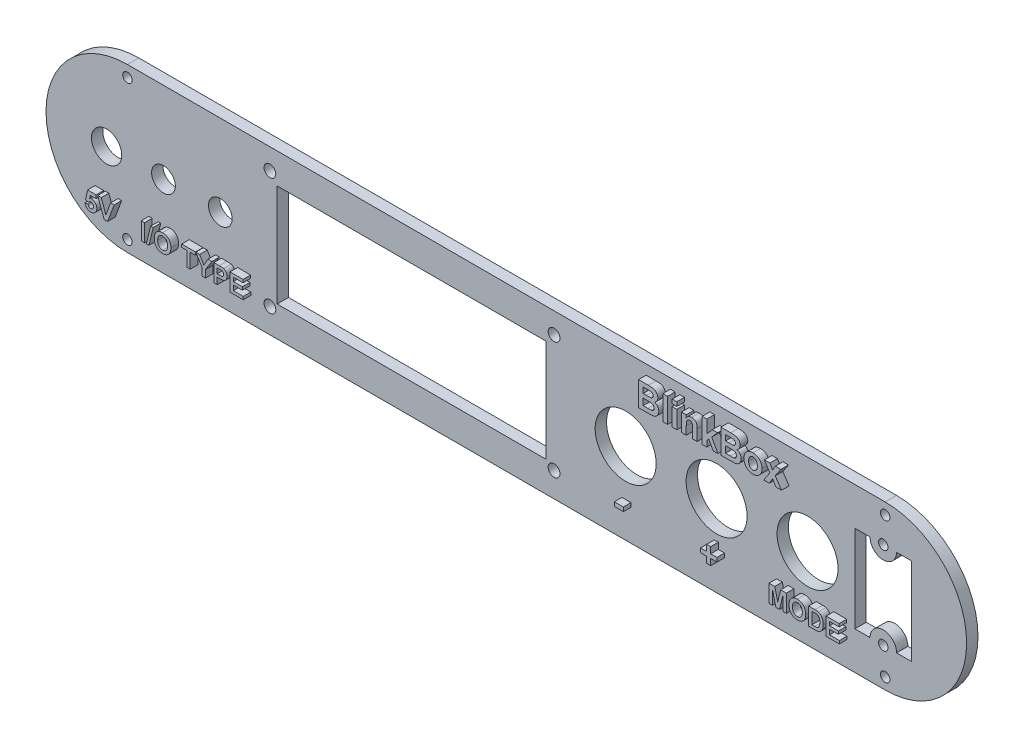
from build123d import *

# Parameters (mm, degrees)
BOSS_EXTRUDE1_DEPTH     = 3
CUT_EXTRUDE1_DEPTH      = 124.424065725
CUT_EXTRUDE1_DEPTH_BACK = 124.424065725
SKETCH2_R               = 4
SKETCH2_R_2             = 3.135
SKETCH2_R_3             = 8.05
SKETCH2_W               = 71
SKETCH2_H               = 27
CUT_EXTRUDE2_DEPTH      = 124.424065725
CUT_EXTRUDE2_DEPTH_BACK = 124.424065725
SKETCH5_R               = 1.55
CUT_EXTRUDE5_DEPTH      = 124.424065725
CUT_EXTRUDE5_DEPTH_BACK = 124.424065725
SKETCH6_R               = 1.25
CUT_EXTRUDE4_DEPTH      = 124.424065725
CUT_EXTRUDE4_DEPTH_BACK = 124.424065725
SKETCH8_R               = 1.25
SKETCH9_W               = 0.889033391
SKETCH9_H               = 4.622973633
SKETCH9_W_2             = 2.387219291
SKETCH9_H_2             = 1.070132785
SKETCH9_W_3             = 1.234768599
SKETCH9_H_3             = 6.420796712
SKETCH9_H_4             = 4.692120674
BOSS_EXTRUDE2_DEPTH     = 2


with BuildPart() as part:
    # Sketch1 → Boss-Extrude1 (new body)
    with BuildSketch(Plane.XY):
        with BuildLine():
            Line((-100, 21.5), (100, 21.5))
            ThreePointArc((100, 21.5), (121.5, 0), (100, -21.5))
            Line((100, -21.5), (-100, -21.5))
            ThreePointArc((-100, -21.5), (-121.5, 0), (-100, 21.5))
        make_face()
    extrude(amount=BOSS_EXTRUDE1_DEPTH)

    # Sketch2 → Cut-Extrude1 (cut, two sides: drawn at the far end of the back side and taken through both)
    with BuildSketch(Plane.XY.offset(3).offset(-CUT_EXTRUDE1_DEPTH_BACK)):
        with Locations((-105.5, 0)):
            Circle(SKETCH2_R)
        with Locations((-90.5, 0)):
            Circle(SKETCH2_R_2)
        with Locations((-75.5, 0)):
            Circle(SKETCH2_R_2)
        with Locations((55.5, 0)):
            Circle(SKETCH2_R_3)
        with Locations((31.5, 0)):
            Circle(SKETCH2_R_3)
        with Locations((79.5, 0)):
            Circle(SKETCH2_R_3)
        with Locations((-25, 0)):
            Rectangle(SKETCH2_W, SKETCH2_H)
    extrude(amount=CUT_EXTRUDE1_DEPTH + CUT_EXTRUDE1_DEPTH_BACK, mode=Mode.SUBTRACT)

    # Sketch5 → Cut-Extrude2 (cut, two sides: drawn at the far end of the back side and taken through both)
    with BuildSketch(Plane.XY.offset(3).offset(-CUT_EXTRUDE2_DEPTH_BACK)):
        with Locations((-62.4, 16)):
            Circle(SKETCH5_R)
        with Locations((-62.4, -15)):
            Circle(SKETCH5_R)
        with Locations((12.6, -15)):
            Circle(SKETCH5_R)
        with Locations((12.6, 16)):
            Circle(SKETCH5_R)
    extrude(amount=CUT_EXTRUDE2_DEPTH + CUT_EXTRUDE2_DEPTH_BACK, mode=Mode.SUBTRACT)

    # Sketch6 → Cut-Extrude5 (cut, two sides: drawn at the far end of the back side and taken through both)
    with BuildSketch(Plane.XY.offset(3).offset(-CUT_EXTRUDE5_DEPTH_BACK)):
        with BuildLine():
            Line((99.5, -8), (99.5, 8))
            ThreePointArc((99.5, 8), (97.025126266, 9.025126266), (96, 11.5))
            Line((96, 11.5), (92, 11.5))
            Line((92, 11.5), (92, -11.5))
            Line((92, -11.5), (96, -11.5))
            ThreePointArc((96, -11.5), (97.025126266, -9.025126266), (99.5, -8))
        make_face()
        with BuildLine():
            ThreePointArc((103, 11.5), (101.974873734, 9.025126266), (99.5, 8))
            Line((99.5, 8), (99.5, -8))
            ThreePointArc((99.5, -8), (101.974873734, -9.025126266), (103, -11.5))
            Line((103, -11.5), (107, -11.5))
            Line((107, -11.5), (107, 11.5))
            Line((107, 11.5), (103, 11.5))
        make_face()
        with BuildLine():
            ThreePointArc((100.75, -11.5), (100.383883476, -10.616116524), (99.5, -10.25))
            Line((99.5, -10.25), (99.5, -11.5))
            Line((99.5, -11.5), (100.75, -11.5))
        make_face()
        with BuildLine():
            Line((99.5, -11.5), (99.5, -10.25))
            ThreePointArc((99.5, -10.25), (98.616116524, -10.616116524), (98.25, -11.5))
            Line((98.25, -11.5), (99.5, -11.5))
        make_face()
        with BuildLine():
            ThreePointArc((100.75, -11.5), (100.383883476, -10.616116524), (99.5, -10.25))
            Line((99.5, -10.25), (99.5, -11.5))
            Line((99.5, -11.5), (100.75, -11.5))
        make_face()
        with BuildLine():
            Line((99.5, -11.5), (99.5, -10.25))
            ThreePointArc((99.5, -10.25), (98.616116524, -10.616116524), (98.25, -11.5))
            Line((98.25, -11.5), (99.5, -11.5))
        make_face()
        with BuildLine():
            Line((100.75, -11.5), (99.5, -11.5))
            Line((99.5, -11.5), (98.25, -11.5))
            ThreePointArc((98.25, -11.5), (99.5, -12.75), (100.75, -11.5))
        make_face()
        with Locations((99.5, 11.5)):
            Circle(SKETCH6_R)
    extrude(amount=CUT_EXTRUDE5_DEPTH + CUT_EXTRUDE5_DEPTH_BACK, mode=Mode.SUBTRACT)

    # Sketch8 → Cut-Extrude4 (cut, two sides: drawn at the far end of the back side and taken through both)
    with BuildSketch(Plane.XY.offset(3).offset(-CUT_EXTRUDE4_DEPTH_BACK)):
        with Locations((-100, 18.5)):
            Circle(SKETCH8_R)
        with Locations((-100, -18.5)):
            Circle(SKETCH8_R)
        with Locations((100, 18.5)):
            Circle(SKETCH8_R)
        with Locations((100, -18.5)):
            Circle(SKETCH8_R)
    extrude(amount=CUT_EXTRUDE4_DEPTH + CUT_EXTRUDE4_DEPTH_BACK, mode=Mode.SUBTRACT)

    # Sketch9 → Boss-Extrude2 (add)
    # profile 1 of 24: a face of its own
    with BuildSketch(Plane.XY.offset(3)):
        with BuildLine():
            Line((-109.174671349, -13.677562831), (-108.404175744, -13.577546575))
            add(Edge.make_bspline(
                [(-108.404175744, -13.577546575), (-108.395651989, -13.629799104), (-108.379238094, -13.730419961), (-108.328284401, -13.870894407), (-108.257324391, -13.994646784), (-108.166127839, -14.098851173), (-108.062334716, -14.183599766), (-107.947669436, -14.244018169), (-107.825605192, -14.28205759), (-107.74106705, -14.286524418), (-107.69850549, -14.288773287)],
                knots=[0, 0, 0, 0, 1.154848647, 2.223851388, 3.245409892, 4.254330626, 5.232966172, 6.156270698, 7.071756339, 8, 8, 8, 8], degree=3))
            add(Edge.make_bspline(
                [(-107.69850549, -14.288773287), (-107.67377931, -14.288338875), (-107.625377432, -14.287488507), (-107.554050291, -14.277835736), (-107.485913267, -14.262153359), (-107.420321692, -14.240869461), (-107.357958746, -14.212876617), (-107.298768979, -14.178620702), (-107.242531196, -14.138053589), (-107.188960746, -14.092182769), (-107.13946122, -14.039810511), (-107.098091971, -13.979526163), (-107.061444045, -13.914410497), (-107.031589229, -13.842694532), (-107.010068065, -13.764126938), (-106.992946429, -13.680052742), (-106.984218646, -13.589456903), (-106.982572293, -13.527244588), (-106.981722318, -13.495125771)],
                knots=[0, 0, 0, 0, 0.981268084, 1.920847364, 2.851509818, 3.754644372, 4.654445699, 5.560569672, 6.465366234, 7.403985617, 8.358004942, 9.316972086, 10.299158387, 11.321223707, 12.392031981, 13.529051644, 14.724304971, 16, 16, 16, 16], degree=3))
            add(Edge.make_bspline(
                [(-106.981722318, -13.495125771), (-106.982202921, -13.464850001), (-106.983131766, -13.406337085), (-106.99174927, -13.321561748), (-107.004977091, -13.242338412), (-107.026020467, -13.169246316), (-107.050053658, -13.10092667), (-107.082456459, -13.039800954), (-107.118010591, -12.983213739), (-107.161345679, -12.934218192), (-107.208563215, -12.890927487), (-107.258849728, -12.85235618), (-107.312769717, -12.820172137), (-107.369786286, -12.792548802), (-107.430887815, -12.7724281), (-107.495578692, -12.759041888), (-107.562989078, -12.748992872), (-107.609254216, -12.748189924), (-107.632754062, -12.747782076)],
                knots=[0, 0, 0, 0, 1.29221626, 2.497420946, 3.635005972, 4.715822244, 5.741640361, 6.720139245, 7.663294346, 8.588224307, 9.502291809, 10.395891443, 11.288713187, 12.178904539, 13.095818132, 14.026458458, 14.997562253, 16, 16, 16, 16], degree=3))
            add(Edge.make_bspline(
                [(-107.632754062, -12.747782076), (-107.662465132, -12.748847262), (-107.721739184, -12.750972324), (-107.809238336, -12.768247003), (-107.894404844, -12.796370302), (-107.977150188, -12.835519891), (-108.057255452, -12.886008613), (-108.134373818, -12.948003903), (-108.209829064, -13.020439136), (-108.256178055, -13.07516949), (-108.2800815, -13.103395433)],
                knots=[0, 0, 0, 0, 0.931687088, 1.85873035, 2.786835662, 3.740075265, 4.723687035, 5.750832598, 6.840042753, 8, 8, 8, 8], degree=3))
            Line((-108.2800815, -13.103395433), (-109.056133564, -12.994118412))
            Line((-109.056133564, -12.994118412), (-108.522713529, -10.43629526))
            Line((-108.522713529, -10.43629526), (-106.270495605, -10.43629526))
            Line((-106.270495605, -10.43629526), (-106.270495605, -11.325328651))
            Line((-106.270495605, -11.325328651), (-107.809634664, -11.325328651))
            Line((-107.809634664, -11.325328651), (-107.991145647, -12.150462767))
            add(Edge.make_bspline(
                [(-107.991145647, -12.150462767), (-107.944891443, -12.123775544), (-107.854815696, -12.071804668), (-107.711009167, -12.018305418), (-107.566463904, -11.983968738), (-107.469024871, -11.979502367), (-107.420682555, -11.977286471)],
                knots=[0, 0, 0, 0, 1.060051984, 2.064352337, 3.039669322, 4, 4, 4, 4], degree=3))
            add(Edge.make_bspline(
                [(-107.420682555, -11.977286471), (-107.375236669, -11.978509437), (-107.285463439, -11.980925268), (-107.153803504, -12.000746395), (-107.027516595, -12.033413647), (-106.906176272, -12.078873547), (-106.790650444, -12.138459615), (-106.679943204, -12.210478444), (-106.575652825, -12.296179756), (-106.476658749, -12.393089274), (-106.386383099, -12.500308), (-106.308422893, -12.617224587), (-106.241087848, -12.740927069), (-106.18626914, -12.872782201), (-106.144989081, -13.012973422), (-106.114074308, -13.160293571), (-106.096756071, -13.315672918), (-106.094063113, -13.421616396), (-106.092688927, -13.475678165)],
                knots=[0, 0, 0, 0, 0.974409932, 1.924837087, 2.848242317, 3.768103797, 4.697919751, 5.630842317, 6.595644344, 7.588240789, 8.59876155, 9.595918743, 10.597287627, 11.615415169, 12.652315553, 13.727511434, 14.840374562, 16, 16, 16, 16], degree=3))
            add(Edge.make_bspline(
                [(-106.092688927, -13.475678165), (-106.093929229, -13.521085583), (-106.096390981, -13.611210234), (-106.110790343, -13.744576227), (-106.137671187, -13.874014515), (-106.171913485, -14.000254276), (-106.219236787, -14.122237829), (-106.275394982, -14.240760417), (-106.342526594, -14.355609212), (-106.394319649, -14.428071574), (-106.42051999, -14.464727813)],
                knots=[0, 0, 0, 0, 1.027524957, 2.039431707, 3.02972907, 4.015954419, 4.995255842, 5.985553205, 6.980960039, 8, 8, 8, 8], degree=3))
            add(Edge.make_bspline(
                [(-106.42051999, -14.464727813), (-106.458714837, -14.511928411), (-106.533886738, -14.60482468), (-106.662571042, -14.726960184), (-106.802530986, -14.829532665), (-106.953387493, -14.913770614), (-107.114979852, -14.979874333), (-107.288037149, -15.02583268), (-107.471290504, -15.054266473), (-107.597148437, -15.057577131), (-107.661462432, -15.059268893)],
                knots=[0, 0, 0, 0, 1.018121711, 2.003781959, 2.967346956, 3.92281574, 4.896313303, 5.889026666, 6.921282725, 8, 8, 8, 8], degree=3))
            add(Edge.make_bspline(
                [(-107.661462432, -15.059268893), (-107.713375358, -15.058331209), (-107.814738181, -15.056500329), (-107.963181763, -15.038394298), (-108.103857304, -15.008978704), (-108.237652306, -14.968158667), (-108.363772348, -14.915143238), (-108.483197355, -14.851136872), (-108.594932313, -14.774720875), (-108.698462692, -14.686472542), (-108.793532182, -14.588932543), (-108.878329982, -14.482206109), (-108.953777812, -14.368078212), (-109.01843626, -14.245395641), (-109.073540538, -14.115018779), (-109.117416884, -13.976279442), (-109.153542454, -13.830102868), (-109.167550427, -13.728972326), (-109.174671349, -13.677562831)],
                knots=[0, 0, 0, 0, 1.098912142, 2.145685936, 3.161086862, 4.139124218, 5.10307886, 6.053641493, 7.003731987, 7.963777669, 8.929946266, 9.883471279, 10.846206077, 11.822909928, 12.81603559, 13.839338588, 14.901632394, 16, 16, 16, 16], degree=3))
        make_face()
    # profile 2 of 24: a face of its own
    with BuildSketch(Plane.XY.offset(3)):
        Polygon((-104.146076232, -15), (-105.855613356, -10.377026367), (-104.916571837, -10.377026367), (-103.692298772, -13.814622145), (-102.472656089, -10.377026367), (-101.528984187, -10.377026367), (-103.232038777, -15), align=None)
    # profile 3 of 24: a face of its own
    with BuildSketch(Plane.XY.offset(3)):
        with Locations((-93.907961332, -12.688513184)):
            Rectangle(SKETCH9_W, SKETCH9_H)
    # profile 4 of 24: a face of its own
    with BuildSketch(Plane.XY.offset(3)):
        Polygon((-93.007815024, -15), (-91.880779985, -10.377026367), (-91.211226713, -10.377026367), (-92.337335675, -15), align=None)
    # profile 5 of 24: a face of its own
    with BuildSketch(Plane.XY.offset(3)):
        with BuildLine():
            add(Edge.make_bspline(
                [(-90.914882249, -12.716295477), (-90.9145551, -12.659166677), (-90.913912622, -12.546973088), (-90.902779963, -12.38238088), (-90.888106252, -12.224613104), (-90.864210138, -12.074290317), (-90.836099582, -11.930708958), (-90.800940739, -11.793911647), (-90.758586782, -11.664378128), (-90.724893874, -11.581672376), (-90.708367201, -11.541104463)],
                knots=[0, 0, 0, 0, 1.141009212, 2.240794809, 3.294380675, 4.305229195, 5.280013876, 6.216333343, 7.125095522, 8, 8, 8, 8], degree=3))
            add(Edge.make_bspline(
                [(-90.708367201, -11.541104463), (-90.681352362, -11.483432477), (-90.627640424, -11.368766821), (-90.527888912, -11.20673503), (-90.414826455, -11.053925923), (-90.289383865, -10.911140588), (-90.15476373, -10.780528577), (-90.010330976, -10.668743503), (-89.861216865, -10.572010145), (-89.75516288, -10.523359015), (-89.702648178, -10.499268458)],
                knots=[0, 0, 0, 0, 1.031372299, 2.050613973, 3.077158538, 4.108712802, 5.127684358, 6.111366908, 7.06480644, 8, 8, 8, 8], degree=3))
            add(Edge.make_bspline(
                [(-89.702648178, -10.499268458), (-89.667001394, -10.484646943), (-89.594950157, -10.455093133), (-89.482974052, -10.41820843), (-89.366749257, -10.388241275), (-89.247116419, -10.361454131), (-89.122914002, -10.342983513), (-88.995145614, -10.327496535), (-88.863112023, -10.319379541), (-88.773802827, -10.318304044), (-88.728415753, -10.317757474)],
                knots=[0, 0, 0, 0, 0.92659354, 1.872881803, 2.832850937, 3.813025581, 4.820167273, 5.851730198, 6.908245912, 8, 8, 8, 8], degree=3))
            add(Edge.make_bspline(
                [(-88.728415753, -10.317757474), (-88.647146683, -10.319794623), (-88.488101996, -10.323781351), (-88.255782371, -10.352577014), (-88.035937468, -10.401201141), (-87.829311465, -10.471481028), (-87.634122897, -10.559332413), (-87.451888264, -10.66830205), (-87.282337854, -10.797210557), (-87.125799144, -10.944290184), (-86.984824825, -11.109284607), (-86.862047904, -11.290652533), (-86.759054666, -11.487544055), (-86.674233788, -11.69941594), (-86.609055335, -11.926960229), (-86.561963964, -12.169534883), (-86.533987876, -12.427318577), (-86.530682, -12.60416961), (-86.528984187, -12.694995719)],
                knots=[0, 0, 0, 0, 1.064641025, 2.083517118, 3.061799897, 4.009540929, 4.938075217, 5.861300345, 6.78508344, 7.723570974, 8.670267188, 9.622657076, 10.586935816, 11.576069104, 12.607749008, 13.683335114, 14.81022093, 16, 16, 16, 16], degree=3))
            add(Edge.make_bspline(
                [(-86.528984187, -12.694995719), (-86.530642786, -12.785213643), (-86.533871767, -12.960851087), (-86.562370045, -13.216611942), (-86.607509077, -13.457418219), (-86.674264589, -13.68271983), (-86.75655392, -13.894235977), (-86.860606984, -14.089447332), (-86.980812585, -14.270943247), (-87.121586677, -14.434159726), (-87.275490751, -14.582083443), (-87.444826095, -14.709485334), (-87.62573415, -14.81860262), (-87.819858513, -14.906707881), (-88.025933917, -14.975540379), (-88.244632876, -15.024538147), (-88.476067554, -15.053223), (-88.634492553, -15.057224203), (-88.715450683, -15.059268893)],
                knots=[0, 0, 0, 0, 1.18845052, 2.313691126, 3.386664782, 4.412527756, 5.405809582, 6.372003093, 7.321919452, 8.268293321, 9.206237639, 10.129603466, 11.054616372, 11.9847576, 12.932764752, 13.912672021, 14.933336461, 16, 16, 16, 16], degree=3))
            add(Edge.make_bspline(
                [(-88.715450683, -15.059268893), (-88.797333567, -15.057219485), (-88.957601895, -15.053208205), (-89.19150504, -15.024610666), (-89.412374958, -14.975596769), (-89.62005437, -14.906522152), (-89.815959688, -14.819755318), (-89.998282193, -14.711753053), (-90.167122668, -14.583544303), (-90.322312701, -14.437361778), (-90.462999746, -14.274625157), (-90.583034672, -14.09429621), (-90.687093163, -13.900991582), (-90.76981513, -13.69178317), (-90.836203043, -13.46882346), (-90.881452377, -13.230829525), (-90.910005761, -12.978456387), (-90.913227042, -12.805279709), (-90.914882249, -12.716295477)],
                knots=[0, 0, 0, 0, 1.080878253, 2.11558926, 3.1052859, 4.062802436, 5.000434901, 5.928596448, 6.853693179, 7.793554778, 8.738606028, 9.68692032, 10.647726704, 11.63151566, 12.651483354, 13.714466703, 14.825613081, 16, 16, 16, 16], degree=3))
        make_face()
        with BuildLine():
            add(Edge.make_bspline(
                [(-90.025848858, -12.685734954), (-90.024960725, -12.749682893), (-90.023240872, -12.87351686), (-90.004922159, -13.053258866), (-89.977122038, -13.221292433), (-89.936237878, -13.377426848), (-89.884588522, -13.521775063), (-89.821307355, -13.654457822), (-89.746655891, -13.775672745), (-89.658703268, -13.882860811), (-89.563545425, -13.978559094), (-89.460831024, -14.061362244), (-89.352474298, -14.13263142), (-89.236600348, -14.188898193), (-89.115620718, -14.233552033), (-88.988595481, -14.266661221), (-88.854893036, -14.284841416), (-88.7636582, -14.287448605), (-88.717302836, -14.288773287)],
                knots=[0, 0, 0, 0, 1.313550922, 2.543666373, 3.708465049, 4.810029406, 5.85539231, 6.85404609, 7.825601258, 8.772642133, 9.696587791, 10.59409323, 11.479048685, 12.35559886, 13.234601248, 14.125357077, 15.047515647, 16, 16, 16, 16], degree=3))
            add(Edge.make_bspline(
                [(-88.717302836, -14.288773287), (-88.670941227, -14.287475445), (-88.5796941, -14.284921082), (-88.446155935, -14.266369168), (-88.318878968, -14.23467911), (-88.198379954, -14.190254095), (-88.084109676, -14.133093874), (-87.976167665, -14.063422403), (-87.875176125, -13.980242535), (-87.78012186, -13.88593451), (-87.694543289, -13.778034511), (-87.620527422, -13.656840507), (-87.557277433, -13.523353023), (-87.505622638, -13.37752212), (-87.465744646, -13.21907342), (-87.439079116, -13.047923088), (-87.42061227, -12.864560495), (-87.418899431, -12.737953387), (-87.418017578, -12.672769884)],
                knots=[0, 0, 0, 0, 0.949153107, 1.868086493, 2.754172764, 3.630100905, 4.492260106, 5.365378617, 6.254840125, 7.166615376, 8.102436631, 9.067266169, 10.06813181, 11.121736829, 12.23011542, 13.408501285, 14.665770308, 16, 16, 16, 16], degree=3))
            add(Edge.make_bspline(
                [(-87.418017578, -12.672769884), (-87.419013642, -12.608215763), (-87.420942614, -12.483200573), (-87.437741972, -12.30215276), (-87.465256214, -12.133715539), (-87.503504052, -11.977932545), (-87.554050973, -11.834778674), (-87.614423354, -11.703862459), (-87.687422138, -11.585867864), (-87.771142798, -11.480855986), (-87.863783564, -11.388425287), (-87.963770501, -11.307506169), (-88.071671697, -11.240176544), (-88.186434056, -11.1835278), (-88.309252373, -11.141500302), (-88.438878527, -11.1108458), (-88.57567935, -11.091968711), (-88.669394751, -11.089509995), (-88.717302836, -11.08825308)],
                knots=[0, 0, 0, 0, 1.332337092, 2.580197383, 3.749299508, 4.852775005, 5.886662144, 6.878700295, 7.822989687, 8.743523536, 9.644687758, 10.519443927, 11.392806431, 12.264866173, 13.155606721, 14.065961015, 15.011303331, 16, 16, 16, 16], degree=3))
            add(Edge.make_bspline(
                [(-88.717302836, -11.08825308), (-88.765216976, -11.089490662), (-88.858944222, -11.091911557), (-88.995958287, -11.111101183), (-89.125992804, -11.14084226), (-89.248793762, -11.185269532), (-89.364555738, -11.241374269), (-89.472850559, -11.310955326), (-89.574531556, -11.391737117), (-89.668002356, -11.485569278), (-89.753079555, -11.591500732), (-89.826113493, -11.7109371), (-89.888390971, -11.842573989), (-89.939486031, -11.986801055), (-89.977363271, -12.144015059), (-90.006475082, -12.313159427), (-90.022823196, -12.495257919), (-90.024818627, -12.620877988), (-90.025848858, -12.685734954)],
                knots=[0, 0, 0, 0, 0.981996942, 1.920933313, 2.83127778, 3.712125466, 4.592427284, 5.463259035, 6.34592384, 7.249932058, 8.173122297, 9.125107726, 10.113123258, 11.154048744, 12.256187849, 13.424658091, 14.670364834, 16, 16, 16, 16], degree=3))
        make_face(mode=Mode.SUBTRACT)
    # profile 6 of 24: a face of its own
    with BuildSketch(Plane.XY.offset(3)):
        Polygon((-82.315922664, -15), (-82.315922664, -11.147521973), (-83.679107197, -11.147521973), (-83.679107197, -10.377026367), (-80.06370474, -10.377026367), (-80.06370474, -11.147521973), (-81.426889273, -11.147521973), (-81.426889273, -15), align=None)
    # profile 7 of 24: a face of its own
    with BuildSketch(Plane.XY.offset(3)):
        Polygon((-78.285637958, -15), (-78.285637958, -13.054313381), (-79.974801401, -10.377026367), (-78.934817549, -10.377026367), (-77.842047339, -12.281965623), (-76.747424977, -10.377026367), (-75.707441125, -10.377026367), (-77.396604567, -13.060795916), (-77.396604567, -15), align=None)
    # profile 8 of 24: a face of its own
    with BuildSketch(Plane.XY.offset(3)):
        with BuildLine():
            Line((-75.203655536, -15), (-75.203655536, -10.377026367))
            Line((-75.203655536, -10.377026367), (-73.724711447, -10.377026367))
            add(Edge.make_bspline(
                [(-73.724711447, -10.377026367), (-73.657723061, -10.377099522), (-73.529599809, -10.377239438), (-73.34683974, -10.381126909), (-73.182291678, -10.386630052), (-73.03619984, -10.393483984), (-72.908050165, -10.403711367), (-72.79841752, -10.415554522), (-72.706611554, -10.428294614), (-72.652549741, -10.441478906), (-72.628236932, -10.447408177)],
                knots=[0, 0, 0, 0, 1.460485487, 2.793352117, 3.985295279, 5.050041172, 5.981765236, 6.787433016, 7.454681457, 8, 8, 8, 8], degree=3))
            add(Edge.make_bspline(
                [(-72.628236932, -10.447408177), (-72.595906809, -10.456626741), (-72.531739088, -10.474923431), (-72.439806754, -10.513929068), (-72.351198541, -10.55913452), (-72.267027718, -10.613011247), (-72.18700816, -10.674602748), (-72.110902013, -10.743406736), (-72.038303414, -10.819733806), (-71.970216671, -10.903433179), (-71.907857224, -10.994082799), (-71.853962994, -11.09181669), (-71.808810897, -11.196210049), (-71.770342062, -11.306478374), (-71.741959571, -11.42380392), (-71.722096988, -11.547371496), (-71.708270152, -11.677235148), (-71.707291169, -11.766103239), (-71.706790865, -11.811518787)],
                knots=[0, 0, 0, 0, 0.907145743, 1.80047177, 2.69161667, 3.591261238, 4.495029544, 5.415863088, 6.359363025, 7.337192411, 8.326890979, 9.326929023, 10.346104993, 11.395420813, 12.477187422, 13.601053412, 14.774031606, 16, 16, 16, 16], degree=3))
            add(Edge.make_bspline(
                [(-71.706790865, -11.811518787), (-71.708217729, -11.880487458), (-71.71096452, -12.013255938), (-71.741696237, -12.203595645), (-71.788569665, -12.377458698), (-71.857078567, -12.533170433), (-71.940605151, -12.671341891), (-72.032611403, -12.795902807), (-72.137669021, -12.90309879), (-72.25117451, -12.994659786), (-72.371129067, -13.069589506), (-72.491300767, -13.133466029), (-72.61331115, -13.18257634), (-72.696497557, -13.203974098), (-72.737513953, -13.214524607)],
                knots=[0, 0, 0, 0, 1.312386234, 2.526415563, 3.661883817, 4.733421185, 5.753802465, 6.732107337, 7.675884281, 8.604170108, 9.50284679, 10.365392406, 11.194030444, 12, 12, 12, 12], degree=3))
            add(Edge.make_bspline(
                [(-72.737513953, -13.214524607), (-72.766789445, -13.220093493), (-72.828498688, -13.231832041), (-72.926365857, -13.243533238), (-73.033339976, -13.256485186), (-73.149861038, -13.264933175), (-73.275788082, -13.272844362), (-73.41107221, -13.276579494), (-73.555520087, -13.28107957), (-73.654942563, -13.281160431), (-73.706189919, -13.281202111)],
                knots=[0, 0, 0, 0, 0.735353946, 1.55003838, 2.431865514, 3.394945452, 4.432993119, 5.54609699, 6.735134699, 8, 8, 8, 8], degree=3))
            Line((-73.706189919, -13.281202111), (-74.314622145, -13.281202111))
            Line((-74.314622145, -13.281202111), (-74.314622145, -15))
            Line((-74.314622145, -15), (-75.203655536, -15))
        make_face()
        with BuildLine():
            Line((-74.314622145, -11.147521973), (-74.314622145, -12.510706505))
            Line((-74.314622145, -12.510706505), (-73.781202111, -12.510706505))
            add(Edge.make_bspline(
                [(-73.781202111, -12.510706505), (-73.735202941, -12.51064694), (-73.647200741, -12.510532985), (-73.520937105, -12.506442654), (-73.406643142, -12.501449646), (-73.304080038, -12.493185196), (-73.213866893, -12.482292849), (-73.13539957, -12.469264231), (-73.068586618, -12.455283161), (-72.996337506, -12.432114289), (-72.91908876, -12.394629167), (-72.836596178, -12.340753631), (-72.764126542, -12.276339074), (-72.7038222, -12.200686407), (-72.655652381, -12.116631911), (-72.621162756, -12.025037004), (-72.598892838, -11.927419734), (-72.596858684, -11.859797721), (-72.595824256, -11.825409933)],
                knots=[0, 0, 0, 0, 1.411705958, 2.700771114, 3.876961699, 4.922619712, 5.858038221, 6.66485904, 7.363650596, 7.950905807, 8.989198271, 9.987739806, 10.967313358, 11.951275539, 12.944273208, 13.927870418, 14.946261014, 16, 16, 16, 16], degree=3))
            add(Edge.make_bspline(
                [(-72.595824256, -11.825409933), (-72.597280099, -11.783526145), (-72.600102787, -11.702319002), (-72.631229151, -11.586666478), (-72.679253574, -11.48171041), (-72.747914864, -11.390716455), (-72.830856087, -11.314198022), (-72.92407856, -11.250531966), (-73.029573091, -11.205977975), (-73.104234942, -11.188714948), (-73.142209361, -11.179934648)],
                knots=[0, 0, 0, 0, 1.085904563, 2.105425768, 3.088705091, 4.068969419, 5.045188284, 6.010769642, 6.988240112, 8, 8, 8, 8], degree=3))
            add(Edge.make_bspline(
                [(-73.142209361, -11.179934648), (-73.158550621, -11.177320997), (-73.194823152, -11.171519502), (-73.255115479, -11.165464919), (-73.326441313, -11.159958283), (-73.408886628, -11.15543717), (-73.502124632, -11.151902707), (-73.606462866, -11.148805645), (-73.721626536, -11.148556837), (-73.802193931, -11.147876485), (-73.844175309, -11.147521973)],
                knots=[0, 0, 0, 0, 0.564603001, 1.253243608, 2.066786758, 3.005752288, 4.070476343, 5.250658742, 6.567396469, 8, 8, 8, 8], degree=3))
            Line((-73.844175309, -11.147521973), (-74.314622145, -11.147521973))
        make_face(mode=Mode.SUBTRACT)
    # profile 9 of 24: a face of its own
    with BuildSketch(Plane.XY.offset(3)):
        Polygon((-70.93629526, -15), (-70.93629526, -10.377026367), (-67.498699482, -10.377026367), (-67.498699482, -11.147521973), (-70.047261869, -11.147521973), (-70.047261869, -12.155093149), (-67.67650616, -12.155093149), (-67.67650616, -12.925588755), (-70.047261869, -12.925588755), (-70.047261869, -14.229504395), (-67.439430589, -14.229504395), (-67.439430589, -15), align=None)
    # profile 10 of 24: a face of its own
    with BuildSketch(Plane.XY.offset(3)):
        Polygon((71.35595257, -15), (71.35595257, -10.377026367), (72.859900723, -10.377026367), (73.63780494, -13.530316676), (74.415709157, -10.377026367), (75.91965731, -10.377026367), (75.91965731, -15), (75.030623919, -15), (75.000989473, -11.360519556), (74.13325584, -15), (73.14235404, -15), (72.274620407, -11.360519556), (72.244985961, -15), align=None)
    # profile 11 of 24: a face of its own
    with BuildSketch(Plane.XY.offset(3)):
        with BuildLine():
            add(Edge.make_bspline(
                [(76.630884023, -12.716295477), (76.631211172, -12.659166677), (76.63185365, -12.546973088), (76.642986308, -12.38238088), (76.657660019, -12.224613104), (76.681556134, -12.074290317), (76.709666689, -11.930708958), (76.744825533, -11.793911647), (76.78717949, -11.664378128), (76.820872398, -11.581672376), (76.837399071, -11.541104463)],
                knots=[0, 0, 0, 0, 1.141009212, 2.240794809, 3.294380675, 4.305229195, 5.280013876, 6.216333343, 7.125095522, 8, 8, 8, 8], degree=3))
            add(Edge.make_bspline(
                [(76.837399071, -11.541104463), (76.86441391, -11.483432477), (76.918125848, -11.368766821), (77.01787736, -11.20673503), (77.130939817, -11.053925923), (77.256382407, -10.911140588), (77.391002542, -10.780528577), (77.535435295, -10.668743503), (77.684549406, -10.572010145), (77.790603392, -10.523359015), (77.843118094, -10.499268458)],
                knots=[0, 0, 0, 0, 1.031372299, 2.050613973, 3.077158538, 4.108712802, 5.127684358, 6.111366908, 7.06480644, 8, 8, 8, 8], degree=3))
            add(Edge.make_bspline(
                [(77.843118094, -10.499268458), (77.878764878, -10.484646943), (77.950816115, -10.455093133), (78.06279222, -10.41820843), (78.179017015, -10.388241275), (78.298649853, -10.361454131), (78.42285227, -10.342983513), (78.550620657, -10.327496535), (78.682654249, -10.319379541), (78.771963445, -10.318304044), (78.817350519, -10.317757474)],
                knots=[0, 0, 0, 0, 0.92659354, 1.872881803, 2.832850937, 3.813025581, 4.820167273, 5.851730198, 6.908245912, 8, 8, 8, 8], degree=3))
            add(Edge.make_bspline(
                [(78.817350519, -10.317757474), (78.898619589, -10.319794623), (79.057664275, -10.323781351), (79.289983901, -10.352577014), (79.509828804, -10.401201141), (79.716454807, -10.471481028), (79.911643375, -10.559332413), (80.093878008, -10.66830205), (80.263428418, -10.797210557), (80.419967127, -10.944290184), (80.560941447, -11.109284607), (80.683718368, -11.290652533), (80.786711606, -11.487544055), (80.871532484, -11.69941594), (80.936710937, -11.926960229), (80.983802308, -12.169534883), (81.011778395, -12.427318577), (81.015084272, -12.60416961), (81.016782085, -12.694995719)],
                knots=[0, 0, 0, 0, 1.064641025, 2.083517118, 3.061799897, 4.009540929, 4.938075217, 5.861300345, 6.78508344, 7.723570974, 8.670267188, 9.622657076, 10.586935816, 11.576069104, 12.607749008, 13.683335114, 14.81022093, 16, 16, 16, 16], degree=3))
            add(Edge.make_bspline(
                [(81.016782085, -12.694995719), (81.015123486, -12.785213643), (81.011894505, -12.960851087), (80.983396227, -13.216611942), (80.938257194, -13.457418219), (80.871501683, -13.68271983), (80.789212352, -13.894235977), (80.685159288, -14.089447332), (80.564953686, -14.270943247), (80.424179595, -14.434159726), (80.270275521, -14.582083443), (80.100940177, -14.709485334), (79.920032122, -14.81860262), (79.725907759, -14.906707881), (79.519832355, -14.975540379), (79.301133396, -15.024538147), (79.069698718, -15.053223), (78.911273719, -15.057224203), (78.830315589, -15.059268893)],
                knots=[0, 0, 0, 0, 1.18845052, 2.313691126, 3.386664782, 4.412527756, 5.405809582, 6.372003093, 7.321919452, 8.268293321, 9.206237639, 10.129603466, 11.054616372, 11.9847576, 12.932764752, 13.912672021, 14.933336461, 16, 16, 16, 16], degree=3))
            add(Edge.make_bspline(
                [(78.830315589, -15.059268893), (78.748432705, -15.057219485), (78.588164376, -15.053208205), (78.354261232, -15.024610666), (78.133391313, -14.975596769), (77.925711901, -14.906522152), (77.729806584, -14.819755318), (77.547484079, -14.711753053), (77.378643604, -14.583544303), (77.223453571, -14.437361778), (77.082766526, -14.274625157), (76.9627316, -14.09429621), (76.858673109, -13.900991582), (76.775951142, -13.69178317), (76.709563229, -13.46882346), (76.664313895, -13.230829525), (76.635760511, -12.978456387), (76.63253923, -12.805279709), (76.630884023, -12.716295477)],
                knots=[0, 0, 0, 0, 1.080878253, 2.11558926, 3.1052859, 4.062802436, 5.000434901, 5.928596448, 6.853693179, 7.793554778, 8.738606028, 9.68692032, 10.647726704, 11.63151566, 12.651483354, 13.714466703, 14.825613081, 16, 16, 16, 16], degree=3))
        make_face()
        with BuildLine():
            add(Edge.make_bspline(
                [(77.519917414, -12.685734954), (77.520805547, -12.749682893), (77.5225254, -12.87351686), (77.540844113, -13.053258866), (77.568644233, -13.221292433), (77.609528394, -13.377426848), (77.66117775, -13.521775063), (77.724458917, -13.654457822), (77.799110381, -13.775672745), (77.887063004, -13.882860811), (77.982220847, -13.978559094), (78.084935248, -14.061362244), (78.193291974, -14.13263142), (78.309165924, -14.188898193), (78.430145554, -14.233552033), (78.557170791, -14.266661221), (78.690873235, -14.284841416), (78.782108072, -14.287448605), (78.828463436, -14.288773287)],
                knots=[0, 0, 0, 0, 1.313550922, 2.543666373, 3.708465049, 4.810029406, 5.85539231, 6.85404609, 7.825601258, 8.772642133, 9.696587791, 10.59409323, 11.479048685, 12.35559886, 13.234601248, 14.125357077, 15.047515647, 16, 16, 16, 16], degree=3))
            add(Edge.make_bspline(
                [(78.828463436, -14.288773287), (78.874825045, -14.287475445), (78.966072172, -14.284921082), (79.099610337, -14.266369168), (79.226887304, -14.23467911), (79.347386318, -14.190254095), (79.461656596, -14.133093874), (79.569598607, -14.063422403), (79.670590147, -13.980242535), (79.765644412, -13.88593451), (79.851222983, -13.778034511), (79.925238849, -13.656840507), (79.988488839, -13.523353023), (80.040143633, -13.37752212), (80.080021626, -13.21907342), (80.106687156, -13.047923088), (80.125154002, -12.864560495), (80.126866841, -12.737953387), (80.127748694, -12.672769884)],
                knots=[0, 0, 0, 0, 0.949153107, 1.868086493, 2.754172764, 3.630100905, 4.492260106, 5.365378617, 6.254840125, 7.166615376, 8.102436631, 9.067266169, 10.06813181, 11.121736829, 12.23011542, 13.408501285, 14.665770308, 16, 16, 16, 16], degree=3))
            add(Edge.make_bspline(
                [(80.127748694, -12.672769884), (80.12675263, -12.608215763), (80.124823657, -12.483200573), (80.1080243, -12.30215276), (80.080510058, -12.133715539), (80.04226222, -11.977932545), (79.991715299, -11.834778674), (79.931342918, -11.703862459), (79.858344134, -11.585867864), (79.774623473, -11.480855986), (79.681982707, -11.388425287), (79.581995771, -11.307506169), (79.474094575, -11.240176544), (79.359332216, -11.1835278), (79.236513899, -11.141500302), (79.106887745, -11.1108458), (78.970086922, -11.091968711), (78.876371521, -11.089509995), (78.828463436, -11.08825308)],
                knots=[0, 0, 0, 0, 1.332337092, 2.580197383, 3.749299508, 4.852775005, 5.886662144, 6.878700295, 7.822989687, 8.743523536, 9.644687758, 10.519443927, 11.392806431, 12.264866173, 13.155606721, 14.065961015, 15.011303331, 16, 16, 16, 16], degree=3))
            add(Edge.make_bspline(
                [(78.828463436, -11.08825308), (78.780549295, -11.089490662), (78.68682205, -11.091911557), (78.549807985, -11.111101183), (78.419773468, -11.14084226), (78.29697251, -11.185269532), (78.181210534, -11.241374269), (78.072915713, -11.310955326), (77.971234716, -11.391737117), (77.877763916, -11.485569278), (77.792686717, -11.591500732), (77.719652779, -11.7109371), (77.657375301, -11.842573989), (77.606280241, -11.986801055), (77.568403001, -12.144015059), (77.53929119, -12.313159427), (77.522943076, -12.495257919), (77.520947644, -12.620877988), (77.519917414, -12.685734954)],
                knots=[0, 0, 0, 0, 0.981996942, 1.920933313, 2.83127778, 3.712125466, 4.592427284, 5.463259035, 6.34592384, 7.249932058, 8.173122297, 9.125107726, 10.113123258, 11.154048744, 12.256187849, 13.424658091, 14.670364834, 16, 16, 16, 16], degree=3))
        make_face(mode=Mode.SUBTRACT)
    # profile 12 of 24: a face of its own
    with BuildSketch(Plane.XY.offset(3)):
        with BuildLine():
            Line((81.78727769, -10.377026367), (83.482923668, -10.377026367))
            add(Edge.make_bspline(
                [(83.482923668, -10.377026367), (83.529234513, -10.377002359), (83.619412484, -10.37695561), (83.750284331, -10.382384891), (83.872666332, -10.387846033), (83.986207223, -10.398778046), (84.09130091, -10.410236733), (84.188135981, -10.424744295), (84.276100724, -10.443337322), (84.331571241, -10.458000148), (84.358065912, -10.46500363)],
                knots=[0, 0, 0, 0, 1.259756885, 2.453039283, 3.563158368, 4.591894114, 5.55549294, 6.43918076, 7.254497783, 8, 8, 8, 8], degree=3))
            add(Edge.make_bspline(
                [(84.358065912, -10.46500363), (84.391199118, -10.475802259), (84.456868722, -10.497205007), (84.553142382, -10.534706186), (84.644356662, -10.581215212), (84.733895504, -10.63010485), (84.817761637, -10.68791116), (84.900393422, -10.748050888), (84.976428189, -10.817716471), (85.076138008, -10.915078711), (85.18991449, -11.05070739), (85.309112692, -11.230612018), (85.410002108, -11.428082099), (85.478934395, -11.605008416), (85.525480152, -11.75541073), (85.555906605, -11.875995249), (85.581752026, -12.00301566), (85.602971197, -12.136503986), (85.619457882, -12.276460244), (85.631732395, -12.422847131), (85.63771132, -12.575791104), (85.639065047, -12.679865958), (85.639755718, -12.732964853)],
                knots=[0, 0, 0, 0, 0.745524535, 1.477620414, 2.207090574, 2.934465325, 3.657932502, 4.384347339, 5.118673636, 5.861150177, 7.365375624, 8.894729774, 10.468936425, 12.099947606, 12.950091786, 13.83580991, 14.759228729, 15.722225242, 16.726454549, 17.773376212, 18.863978586, 20, 20, 20, 20], degree=3))
            add(Edge.make_bspline(
                [(85.639755718, -12.732964853), (85.638494927, -12.824736042), (85.636056584, -13.002219678), (85.60780822, -13.258327824), (85.567098759, -13.496205818), (85.521210752, -13.644604453), (85.498992097, -13.716458042)],
                knots=[0, 0, 0, 0, 1.103207939, 2.133582005, 3.096293362, 4, 4, 4, 4], degree=3))
            add(Edge.make_bspline(
                [(85.498992097, -13.716458042), (85.484320423, -13.757689198), (85.455458952, -13.838797313), (85.404953541, -13.955796168), (85.350382088, -14.067137883), (85.291291945, -14.172734735), (85.22738457, -14.272111745), (85.158420928, -14.364971672), (85.085470009, -14.452537045), (85.032621289, -14.506433946), (85.006319426, -14.53325747)],
                knots=[0, 0, 0, 0, 1.090884612, 2.145940218, 3.175104604, 4.181306866, 5.161203701, 6.118658341, 7.063689906, 8, 8, 8, 8], degree=3))
            add(Edge.make_bspline(
                [(85.006319426, -14.53325747), (84.963756658, -14.571534502), (84.875986162, -14.650467199), (84.721319517, -14.748149566), (84.546502716, -14.83446439), (84.420050931, -14.878802883), (84.354361606, -14.901835896)],
                knots=[0, 0, 0, 0, 0.908140292, 1.872714733, 2.8949153, 4, 4, 4, 4], degree=3))
            add(Edge.make_bspline(
                [(84.354361606, -14.901835896), (84.327918319, -14.909957417), (84.273036645, -14.926813214), (84.18601634, -14.944815553), (84.09311998, -14.963781196), (83.993276343, -14.975206391), (83.887521854, -14.987254766), (83.775013747, -14.994019254), (83.656142027, -14.998821648), (83.57461083, -14.999601392), (83.532931796, -15)],
                knots=[0, 0, 0, 0, 0.799129865, 1.658552685, 2.566799617, 3.538529252, 4.561352959, 5.643373779, 6.795284424, 8, 8, 8, 8], degree=3))
            Line((83.532931796, -15), (81.78727769, -15))
            Line((81.78727769, -15), (81.78727769, -10.377026367))
        make_face()
        with BuildLine():
            Line((82.676311081, -11.147521973), (82.676311081, -14.229504395))
            Line((82.676311081, -14.229504395), (83.407911476, -14.229504395))
            add(Edge.make_bspline(
                [(83.407911476, -14.229504395), (83.440941316, -14.229242445), (83.504536375, -14.228738093), (83.596560055, -14.227256115), (83.681129043, -14.223244119), (83.758686363, -14.219088346), (83.829030102, -14.212222281), (83.892466339, -14.205469245), (83.948641956, -14.196021888), (83.983337397, -14.188564269), (83.999674327, -14.185052725)],
                knots=[0, 0, 0, 0, 1.333384787, 2.567275092, 3.714769766, 4.750907381, 5.701951617, 6.567520054, 7.325492842, 8, 8, 8, 8], degree=3))
            add(Edge.make_bspline(
                [(83.999674327, -14.185052725), (84.037937267, -14.174842274), (84.112463382, -14.15495501), (84.217105582, -14.110620573), (84.311793291, -14.057135926), (84.39811224, -13.992822937), (84.47590348, -13.911546194), (84.542307813, -13.807599613), (84.603763273, -13.68362865), (84.645847986, -13.564957436), (84.676056313, -13.458963082), (84.696504872, -13.369999406), (84.712664815, -13.273749703), (84.726564474, -13.170593839), (84.737795728, -13.060664464), (84.744784347, -12.943564608), (84.749554122, -12.81943761), (84.750325548, -12.73420447), (84.750722327, -12.690365336)],
                knots=[0, 0, 0, 0, 1.038686998, 2.023088296, 2.974059649, 3.888265163, 4.839857954, 5.909819677, 7.113156087, 8.466843969, 9.20827164, 10.006482943, 10.861893492, 11.769681931, 12.739021491, 13.762258324, 14.849031541, 16, 16, 16, 16], degree=3))
            add(Edge.make_bspline(
                [(84.750722327, -12.690365336), (84.7503286, -12.646526068), (84.749565876, -12.561601147), (84.744803417, -12.438399698), (84.737854054, -12.323143838), (84.726542814, -12.215691092), (84.712858623, -12.115892953), (84.696509393, -12.023664968), (84.676184101, -11.939612401), (84.64595008, -11.8397564), (84.600116862, -11.727515152), (84.537746796, -11.604796642), (84.461154209, -11.5002002), (84.376526859, -11.409335562), (84.278950094, -11.334558555), (84.170932851, -11.271928458), (84.050123286, -11.223317436), (83.964187647, -11.202612407), (83.920031752, -11.191973642)],
                knots=[0, 0, 0, 0, 1.117996097, 2.165769068, 3.143980016, 4.062055362, 4.920439205, 5.712587309, 6.449616741, 7.124491204, 8.371470382, 9.537068822, 10.625202851, 11.666538334, 12.693249444, 13.747832046, 14.842779399, 16, 16, 16, 16], degree=3))
            add(Edge.make_bspline(
                [(83.920031752, -11.191973642), (83.900918929, -11.188422212), (83.85883981, -11.180603323), (83.789013561, -11.171470814), (83.707091812, -11.164693713), (83.612656942, -11.157774887), (83.506091326, -11.15382584), (83.386949068, -11.149704367), (83.255728722, -11.148296479), (83.164044349, -11.14778756), (83.116197394, -11.147521973)],
                knots=[0, 0, 0, 0, 0.578738571, 1.274160813, 2.095454135, 3.025967819, 4.093109015, 5.270126069, 6.575371698, 8, 8, 8, 8], degree=3))
            Line((83.116197394, -11.147521973), (82.676311081, -11.147521973))
        make_face(mode=Mode.SUBTRACT)
    # profile 13 of 24: a face of its own
    with BuildSketch(Plane.XY.offset(3)):
        Polygon((86.410251323, -15), (86.410251323, -10.377026367), (89.847847101, -10.377026367), (89.847847101, -11.147521973), (87.299284714, -11.147521973), (87.299284714, -12.155093149), (89.670040423, -12.155093149), (89.670040423, -12.925588755), (87.299284714, -12.925588755), (87.299284714, -14.229504395), (89.907115994, -14.229504395), (89.907115994, -15), align=None)
    # profile 14 of 24: a face of its own
    with BuildSketch(Plane.XY.offset(3)):
        Polygon((54.882615701, -14.094503028), (54.882615701, -12.448144896), (53.236257569, -12.448144896), (53.236257569, -11.378012111), (54.882615701, -11.378012111), (54.882615701, -9.73165398), (55.952748486, -9.73165398), (55.952748486, -11.378012111), (57.599106617, -11.378012111), (57.599106617, -12.448144896), (55.952748486, -12.448144896), (55.952748486, -14.094503028), align=None)
    # profile 15 of 24: a face of its own
    with BuildSketch(Plane.XY.offset(3)):
        with Locations((31.705794767, -12.73625757)):
            Rectangle(SKETCH9_W_2, SKETCH9_H_2)
    # profile 16 of 24: a face of its own
    with BuildSketch(Plane.XY.offset(3)):
        with BuildLine():
            Line((36.896153116, 18.920796712), (39.482736086, 18.920796712))
            add(Edge.make_bspline(
                [(39.482736086, 18.920796712), (39.544902711, 18.920426823), (39.664953583, 18.919712525), (39.83905986, 18.917721855), (40.000664864, 18.91187574), (40.150020241, 18.906855716), (40.286629257, 18.895115965), (40.411565569, 18.885892478), (40.524435819, 18.87320336), (40.657399913, 18.8526686), (40.812013669, 18.820728229), (40.98664612, 18.761647185), (41.15218056, 18.687831199), (41.30612885, 18.593985468), (41.449002371, 18.484226988), (41.58189382, 18.359429992), (41.698673217, 18.214551546), (41.803831221, 18.05642793), (41.892592092, 17.884926338), (41.953714944, 17.700424773), (41.992721828, 17.506306095), (41.99744969, 17.373239819), (41.999863323, 17.305307796)],
                knots=[0, 0, 0, 0, 1.096610875, 2.117681168, 3.071055591, 3.949137991, 4.753059115, 5.489127199, 6.15892391, 6.75575099, 7.862330316, 8.938514814, 10.001276227, 11.05313779, 12.110449801, 13.174958802, 14.260456508, 15.384725817, 16.521138801, 17.654729897, 18.802709851, 20, 20, 20, 20], degree=3))
            add(Edge.make_bspline(
                [(41.999863323, 17.305307796), (41.997360044, 17.231331543), (41.992424134, 17.085466783), (41.946481734, 16.87157061), (41.87330083, 16.666921601), (41.769979904, 16.474839659), (41.643432768, 16.298570312), (41.493748652, 16.143784438), (41.323126884, 16.011423165), (41.195010005, 15.945559777), (41.130380435, 15.912334471)],
                knots=[0, 0, 0, 0, 1.023065178, 2.01725758, 3.014298905, 4.023406433, 5.026736079, 6.009055718, 6.99565244, 8, 8, 8, 8], degree=3))
            add(Edge.make_bspline(
                [(41.130380435, 15.912334471), (41.173909687, 15.897507975), (41.259978217, 15.868192178), (41.383172074, 15.814359996), (41.498598048, 15.751930998), (41.606198175, 15.682873774), (41.706789105, 15.606683493), (41.797431964, 15.520833868), (41.883327891, 15.430209118), (41.958737852, 15.330260152), (42.026995441, 15.225767376), (42.084935932, 15.115095264), (42.135107572, 15.000905765), (42.177067044, 14.882043207), (42.206976823, 14.757710382), (42.2309424, 14.629473561), (42.243202521, 14.496443977), (42.245602311, 14.406622477), (42.246817043, 14.361156419)],
                knots=[0, 0, 0, 0, 1.072651974, 2.1209089, 3.132484228, 4.131466326, 5.101889999, 6.071643115, 7.041396231, 8.011819904, 8.988565287, 9.95070344, 10.922775742, 11.897213062, 12.887138018, 13.903598663, 14.938838629, 16, 16, 16, 16], degree=3))
            add(Edge.make_bspline(
                [(42.246817043, 14.361156419), (42.244233455, 14.288550244), (42.239078205, 14.143673062), (42.200553674, 13.927547197), (42.135489472, 13.715227695), (42.047379114, 13.508091943), (41.937936329, 13.312779713), (41.809269639, 13.134459997), (41.65914948, 12.979304671), (41.49290439, 12.84259023), (41.305571215, 12.729410168), (41.09731001, 12.642471999), (40.869436848, 12.576791921), (40.708901284, 12.554973574), (40.626183257, 12.543731388)],
                knots=[0, 0, 0, 0, 0.975059807, 1.945618526, 2.93861228, 3.952760547, 4.963632603, 5.940527786, 6.897802811, 7.855787948, 8.824773195, 9.82606706, 10.879852914, 12, 12, 12, 12], degree=3))
            add(Edge.make_bspline(
                [(40.626183257, 12.543731388), (40.59446461, 12.541055749), (40.521652014, 12.534913614), (40.398165901, 12.527277271), (40.246333601, 12.521505046), (40.066286955, 12.514680121), (39.857471695, 12.509752326), (39.620362402, 12.506387308), (39.354554504, 12.502020178), (39.168043455, 12.500696703), (39.069860336, 12.5)],
                knots=[0, 0, 0, 0, 0.490565993, 1.126131979, 1.906526787, 2.832178623, 3.902933831, 5.125497984, 6.486805064, 8, 8, 8, 8], degree=3))
            Line((39.069860336, 12.5), (36.896153116, 12.5))
            Line((36.896153116, 12.5), (36.896153116, 18.920796712))
        make_face()
        with BuildLine():
            Line((38.130921714, 17.850663927), (38.130921714, 16.368941609))
            Line((38.130921714, 16.368941609), (39.024842731, 16.368941609))
            add(Edge.make_bspline(
                [(39.024842731, 16.368941609), (39.087867937, 16.368802757), (39.20791756, 16.368538275), (39.378552017, 16.370310616), (39.530764455, 16.371138024), (39.664117262, 16.373566338), (39.778583056, 16.377573956), (39.873749403, 16.381575887), (39.950166231, 16.384605812), (39.994661976, 16.388932409), (40.013943827, 16.390807303)],
                knots=[0, 0, 0, 0, 1.528479216, 2.911428072, 4.138414629, 5.21998762, 6.145918986, 6.915989543, 7.530253335, 8, 8, 8, 8], degree=3))
            add(Edge.make_bspline(
                [(40.013943827, 16.390807303), (40.069549668, 16.399174716), (40.176420683, 16.415256372), (40.32596957, 16.462379407), (40.455683421, 16.530534173), (40.567002102, 16.615368863), (40.655365911, 16.719451089), (40.720211286, 16.839183325), (40.758150599, 16.975068686), (40.762722268, 17.070545208), (40.765094724, 17.120092506)],
                knots=[0, 0, 0, 0, 1.162079002, 2.233444551, 3.225172046, 4.179556897, 5.110707885, 6.027301426, 6.976273101, 8, 8, 8, 8], degree=3))
            add(Edge.make_bspline(
                [(40.765094724, 17.120092506), (40.763605449, 17.167937198), (40.76074641, 17.259787113), (40.725230523, 17.389833856), (40.671835058, 17.506626252), (40.593785117, 17.607294994), (40.495844491, 17.692310839), (40.375970274, 17.758719894), (40.234738103, 17.804415616), (40.133007701, 17.820398208), (40.079540909, 17.828798233)],
                knots=[0, 0, 0, 0, 1.044241546, 2.004684189, 2.928111627, 3.838334562, 4.769594837, 5.748424953, 6.81663206, 8, 8, 8, 8], degree=3))
            add(Edge.make_bspline(
                [(40.079540909, 17.828798233), (40.058543376, 17.830678806), (40.008901448, 17.835124816), (39.922623162, 17.838015047), (39.812882263, 17.842082858), (39.679119374, 17.846052833), (39.521330875, 17.848476725), (39.339965524, 17.849293659), (39.135031421, 17.85107374), (38.990544085, 17.85080557), (38.914228044, 17.850663927)],
                knots=[0, 0, 0, 0, 0.433943041, 1.02591908, 1.776648879, 2.694999143, 3.780816848, 5.02540149, 6.428861738, 8, 8, 8, 8], degree=3))
            Line((38.914228044, 17.850663927), (38.130921714, 17.850663927))
        make_face(mode=Mode.SUBTRACT)
        with BuildLine():
            Line((38.130921714, 15.298808823), (38.130921714, 13.570132785))
            Line((38.130921714, 13.570132785), (39.391414659, 13.570132785))
            add(Edge.make_bspline(
                [(39.391414659, 13.570132785), (39.450154826, 13.569841404), (39.561639486, 13.569288382), (39.720679385, 13.572992449), (39.862654365, 13.574213816), (39.988228933, 13.580307282), (40.096743217, 13.584916927), (40.18864372, 13.590663622), (40.263212886, 13.599802528), (40.307217954, 13.606897519), (40.326494629, 13.610005521)],
                knots=[0, 0, 0, 0, 1.504773752, 2.85595359, 4.075347731, 5.141676974, 6.076328919, 6.858106537, 7.499786952, 8, 8, 8, 8], degree=3))
            add(Edge.make_bspline(
                [(40.326494629, 13.610005521), (40.375447502, 13.620334248), (40.47055912, 13.640402158), (40.602382596, 13.69798717), (40.721191491, 13.771015419), (40.824089181, 13.864872019), (40.908665748, 13.977309646), (40.969736043, 14.108575954), (41.006565542, 14.257126535), (41.010167117, 14.361790972), (41.012048444, 14.416463762)],
                knots=[0, 0, 0, 0, 1.031056579, 2.003262591, 2.954260215, 3.900917722, 4.862741126, 5.841340256, 6.872396835, 8, 8, 8, 8], degree=3))
            add(Edge.make_bspline(
                [(41.012048444, 14.416463762), (41.010530165, 14.463350386), (41.007575012, 14.554609725), (40.978648014, 14.68532121), (40.93185387, 14.804834289), (40.866687178, 14.912333399), (40.785269371, 15.009168631), (40.684620583, 15.090206176), (40.568419221, 15.157723119), (40.457645095, 15.202202522), (40.352602512, 15.230738708), (40.252413938, 15.249459005), (40.131666231, 15.26427754), (39.990944772, 15.27681238), (39.829678524, 15.286836306), (39.648300896, 15.294738509), (39.446305741, 15.298045893), (39.304809814, 15.298546437), (39.230637497, 15.298808823)],
                knots=[0, 0, 0, 0, 0.992165387, 1.931134082, 2.820086661, 3.700270762, 4.583075858, 5.486803518, 6.423132184, 7.421722103, 8.005700193, 8.727213115, 9.57900282, 10.582332745, 11.720121093, 13.002085041, 14.428489784, 16, 16, 16, 16], degree=3))
            Line((39.230637497, 15.298808823), (38.130921714, 15.298808823))
        make_face(mode=Mode.SUBTRACT)
    # profile 17 of 24: a face of its own
    with BuildSketch(Plane.XY.offset(3)):
        with Locations((43.934334128, 15.710398356)):
            Rectangle(SKETCH9_W_3, SKETCH9_H_3)
    # profile 18 of 24: a face of its own
    with BuildSketch(Plane.XY.offset(3)):
        with Locations((46.403871325, 18.385730319)):
            Rectangle(SKETCH9_W_3, SKETCH9_H_2)
    # profile 19 of 24: a face of its own
    with BuildSketch(Plane.XY.offset(3)):
        with Locations((46.403871325, 14.846060337)):
            Rectangle(SKETCH9_W_3, SKETCH9_H_4)
    # profile 20 of 24: a face of its own
    with BuildSketch(Plane.XY.offset(3)):
        with BuildLine():
            Line((52.37191955, 12.5), (51.137150952, 12.5))
            Line((51.137150952, 12.5), (51.137150952, 14.907798767))
            add(Edge.make_bspline(
                [(51.137150952, 14.907798767), (51.136966317, 14.968683155), (51.136613908, 15.084891592), (51.132311416, 15.250382898), (51.127679345, 15.399206207), (51.120232911, 15.530899781), (51.110005169, 15.646299418), (51.097834529, 15.744687039), (51.082504099, 15.826262603), (51.060752709, 15.911346725), (51.026600161, 16.001632982), (50.971172946, 16.095145617), (50.906919213, 16.178178546), (50.82908313, 16.246103933), (50.74184991, 16.300877702), (50.646071092, 16.341257196), (50.541046783, 16.364836881), (50.468438774, 16.367545583), (50.43101766, 16.368941609)],
                knots=[0, 0, 0, 0, 1.585090075, 3.025419896, 4.30986405, 5.461533023, 6.458985685, 7.325703005, 8.041573048, 8.618245387, 9.611190897, 10.541623111, 11.439410311, 12.333024322, 13.215695708, 14.111259627, 15.026570636, 16, 16, 16, 16], degree=3))
            add(Edge.make_bspline(
                [(50.43101766, 16.368941609), (50.382838007, 16.366550069), (50.287959243, 16.361840479), (50.148644636, 16.329219277), (50.018527215, 16.271444099), (49.897065986, 16.194318503), (49.789964217, 16.098550234), (49.698900976, 15.986702937), (49.6270774, 15.860179824), (49.582329301, 15.74204398), (49.555776247, 15.635114709), (49.537706027, 15.538536413), (49.524759904, 15.425844714), (49.511085748, 15.298185114), (49.503372389, 15.154356442), (49.494765721, 14.995782335), (49.491596928, 14.821204961), (49.491068922, 14.699859798), (49.490792821, 14.636406919)],
                knots=[0, 0, 0, 0, 1.032418065, 2.033110358, 3.045378521, 4.070039643, 5.104744895, 6.110696385, 7.147805894, 8.209255037, 8.806501049, 9.507534436, 10.313289552, 11.236712342, 12.258650821, 13.399345464, 14.640085731, 16, 16, 16, 16], degree=3))
            Line((49.490792821, 14.636406919), (49.490792821, 12.5))
            Line((49.490792821, 12.5), (48.256024222, 12.5))
            Line((48.256024222, 12.5), (48.256024222, 17.192120674))
            Line((48.256024222, 17.192120674), (49.490792821, 17.192120674))
            Line((49.490792821, 17.192120674), (49.490792821, 16.51557038))
            add(Edge.make_bspline(
                [(49.490792821, 16.51557038), (49.538530514, 16.575719452), (49.631527881, 16.692895314), (49.787222419, 16.848624006), (49.952117344, 16.980784757), (50.126956313, 17.088666157), (50.311649638, 17.17193981), (50.505351397, 17.23058927), (50.708221242, 17.268530496), (50.846722535, 17.272445951), (50.917207795, 17.274438581)],
                knots=[0, 0, 0, 0, 1.096260936, 2.135615983, 3.138008533, 4.108575778, 5.062498258, 6.023394349, 6.994077526, 8, 8, 8, 8], degree=3))
            add(Edge.make_bspline(
                [(50.917207795, 17.274438581), (50.979063118, 17.272883258), (51.100874206, 17.269820376), (51.278963022, 17.240421042), (51.449005584, 17.194259906), (51.608631118, 17.129873029), (51.75538036, 17.053092188), (51.884308748, 16.963319682), (51.995129604, 16.864318269), (52.086016671, 16.7531692), (52.160012626, 16.633566506), (52.224419084, 16.508057419), (52.274188631, 16.373683351), (52.312604062, 16.227673012), (52.338647158, 16.062171544), (52.359408147, 15.869930868), (52.369883053, 15.646200778), (52.371212399, 15.486604233), (52.37191955, 15.401706206)],
                knots=[0, 0, 0, 0, 1.087471829, 2.141547729, 3.166311014, 4.181815879, 5.163737, 6.073971965, 6.939083136, 7.769667735, 8.590016746, 9.409741311, 10.247555639, 11.105633939, 12.06171977, 13.192085209, 14.506318385, 16, 16, 16, 16], degree=3))
            Line((52.37191955, 15.401706206), (52.37191955, 12.5))
        make_face()
    # profile 21 of 24: a face of its own
    with BuildSketch(Plane.XY.offset(3)):
        Polygon((53.689006056, 12.5), (53.689006056, 18.920796712), (54.923774654, 18.920796712), (54.923774654, 15.539331457), (56.364338019, 17.192120674), (57.763742431, 17.192120674), (56.213850596, 15.451868681), (57.846060337, 12.5), (56.611291739, 12.5), (55.433116701, 14.574668489), (54.923774654, 14.002301795), (54.923774654, 12.5), align=None)
    # profile 22 of 24: a face of its own
    with BuildSketch(Plane.XY.offset(3)):
        with BuildLine():
            Line((58.62808045, 18.920796712), (61.21466342, 18.920796712))
            add(Edge.make_bspline(
                [(61.21466342, 18.920796712), (61.276830045, 18.920426823), (61.396880917, 18.919712525), (61.570987194, 18.917721855), (61.732592197, 18.91187574), (61.881947575, 18.906855716), (62.018556591, 18.895115965), (62.143492903, 18.885892478), (62.256363153, 18.87320336), (62.389327247, 18.8526686), (62.543941002, 18.820728229), (62.718573454, 18.761647185), (62.884107894, 18.687831199), (63.038056183, 18.593985468), (63.180929705, 18.484226988), (63.313821153, 18.359429992), (63.430600551, 18.214551546), (63.535758555, 18.05642793), (63.624519425, 17.884926338), (63.685642278, 17.700424773), (63.724649162, 17.506306095), (63.729377023, 17.373239819), (63.731790657, 17.305307796)],
                knots=[0, 0, 0, 0, 1.096610875, 2.117681168, 3.071055591, 3.949137991, 4.753059115, 5.489127199, 6.15892391, 6.75575099, 7.862330316, 8.938514814, 10.001276227, 11.05313779, 12.110449801, 13.174958802, 14.260456508, 15.384725817, 16.521138801, 17.654729897, 18.802709851, 20, 20, 20, 20], degree=3))
            add(Edge.make_bspline(
                [(63.731790657, 17.305307796), (63.729287378, 17.231331543), (63.724351468, 17.085466783), (63.678409068, 16.87157061), (63.605228163, 16.666921601), (63.501907237, 16.474839659), (63.375360101, 16.298570312), (63.225675986, 16.143784438), (63.055054217, 16.011423165), (62.926937339, 15.945559777), (62.862307769, 15.912334471)],
                knots=[0, 0, 0, 0, 1.023065178, 2.01725758, 3.014298905, 4.023406433, 5.026736079, 6.009055718, 6.99565244, 8, 8, 8, 8], degree=3))
            add(Edge.make_bspline(
                [(62.862307769, 15.912334471), (62.905837021, 15.897507975), (62.991905551, 15.868192178), (63.115099408, 15.814359996), (63.230525382, 15.751930998), (63.338125509, 15.682873774), (63.438716438, 15.606683493), (63.529359298, 15.520833868), (63.615255224, 15.430209118), (63.690665186, 15.330260152), (63.758922774, 15.225767376), (63.816863265, 15.115095264), (63.867034906, 15.000905765), (63.908994377, 14.882043207), (63.938904156, 14.757710382), (63.962869734, 14.629473561), (63.975129854, 14.496443977), (63.977529645, 14.406622477), (63.978744376, 14.361156419)],
                knots=[0, 0, 0, 0, 1.072651974, 2.1209089, 3.132484228, 4.131466326, 5.101889999, 6.071643115, 7.041396231, 8.011819904, 8.988565287, 9.95070344, 10.922775742, 11.897213062, 12.887138018, 13.903598663, 14.938838629, 16, 16, 16, 16], degree=3))
            add(Edge.make_bspline(
                [(63.978744376, 14.361156419), (63.976160788, 14.288550244), (63.971005538, 14.143673062), (63.932481008, 13.927547197), (63.867416806, 13.715227695), (63.779306448, 13.508091943), (63.669863663, 13.312779713), (63.541196973, 13.134459997), (63.391076813, 12.979304671), (63.224831724, 12.84259023), (63.037498549, 12.729410168), (62.829237344, 12.642471999), (62.601364181, 12.576791921), (62.440828618, 12.554973574), (62.358110591, 12.543731388)],
                knots=[0, 0, 0, 0, 0.975059807, 1.945618526, 2.93861228, 3.952760547, 4.963632603, 5.940527786, 6.897802811, 7.855787948, 8.824773195, 9.82606706, 10.879852914, 12, 12, 12, 12], degree=3))
            add(Edge.make_bspline(
                [(62.358110591, 12.543731388), (62.326391943, 12.541055749), (62.253579348, 12.534913614), (62.130093234, 12.527277271), (61.978260935, 12.521505046), (61.798214289, 12.514680121), (61.589399029, 12.509752326), (61.352289736, 12.506387308), (61.086481838, 12.502020178), (60.899970789, 12.500696703), (60.80178767, 12.5)],
                knots=[0, 0, 0, 0, 0.490565993, 1.126131979, 1.906526787, 2.832178623, 3.902933831, 5.125497984, 6.486805064, 8, 8, 8, 8], degree=3))
            Line((60.80178767, 12.5), (58.62808045, 12.5))
            Line((58.62808045, 12.5), (58.62808045, 18.920796712))
        make_face()
        with BuildLine():
            Line((59.862849048, 17.850663927), (59.862849048, 16.368941609))
            Line((59.862849048, 16.368941609), (60.756770065, 16.368941609))
            add(Edge.make_bspline(
                [(60.756770065, 16.368941609), (60.819795271, 16.368802757), (60.939844894, 16.368538275), (61.11047935, 16.370310616), (61.262691789, 16.371138024), (61.396044595, 16.373566338), (61.51051039, 16.377573956), (61.605676737, 16.381575887), (61.682093565, 16.384605812), (61.72658931, 16.388932409), (61.745871161, 16.390807303)],
                knots=[0, 0, 0, 0, 1.528479216, 2.911428072, 4.138414629, 5.21998762, 6.145918986, 6.915989543, 7.530253335, 8, 8, 8, 8], degree=3))
            add(Edge.make_bspline(
                [(61.745871161, 16.390807303), (61.801477002, 16.399174716), (61.908348016, 16.415256372), (62.057896904, 16.462379407), (62.187610755, 16.530534173), (62.298929436, 16.615368863), (62.387293244, 16.719451089), (62.45213862, 16.839183325), (62.490077933, 16.975068686), (62.494649602, 17.070545208), (62.497022058, 17.120092506)],
                knots=[0, 0, 0, 0, 1.162079002, 2.233444551, 3.225172046, 4.179556897, 5.110707885, 6.027301426, 6.976273101, 8, 8, 8, 8], degree=3))
            add(Edge.make_bspline(
                [(62.497022058, 17.120092506), (62.495532783, 17.167937198), (62.492673744, 17.259787113), (62.457157857, 17.389833856), (62.403762392, 17.506626252), (62.32571245, 17.607294994), (62.227771824, 17.692310839), (62.107897608, 17.758719894), (61.966665437, 17.804415616), (61.864935035, 17.820398208), (61.811468243, 17.828798233)],
                knots=[0, 0, 0, 0, 1.044241546, 2.004684189, 2.928111627, 3.838334562, 4.769594837, 5.748424953, 6.81663206, 8, 8, 8, 8], degree=3))
            add(Edge.make_bspline(
                [(61.811468243, 17.828798233), (61.79047071, 17.830678806), (61.740828782, 17.835124816), (61.654550496, 17.838015047), (61.544809597, 17.842082858), (61.411046707, 17.846052833), (61.253258209, 17.848476725), (61.071892858, 17.849293659), (60.866958754, 17.85107374), (60.722471419, 17.85080557), (60.646155378, 17.850663927)],
                knots=[0, 0, 0, 0, 0.433943041, 1.02591908, 1.776648879, 2.694999143, 3.780816848, 5.02540149, 6.428861738, 8, 8, 8, 8], degree=3))
            Line((60.646155378, 17.850663927), (59.862849048, 17.850663927))
        make_face(mode=Mode.SUBTRACT)
        with BuildLine():
            Line((59.862849048, 15.298808823), (59.862849048, 13.570132785))
            Line((59.862849048, 13.570132785), (61.123341992, 13.570132785))
            add(Edge.make_bspline(
                [(61.123341992, 13.570132785), (61.182082159, 13.569841404), (61.29356682, 13.569288382), (61.452606718, 13.572992449), (61.594581699, 13.574213816), (61.720156266, 13.580307282), (61.82867055, 13.584916927), (61.920571054, 13.590663622), (61.99514022, 13.599802528), (62.039145288, 13.606897519), (62.058421962, 13.610005521)],
                knots=[0, 0, 0, 0, 1.504773752, 2.85595359, 4.075347731, 5.141676974, 6.076328919, 6.858106537, 7.499786952, 8, 8, 8, 8], degree=3))
            add(Edge.make_bspline(
                [(62.058421962, 13.610005521), (62.107374836, 13.620334248), (62.202486454, 13.640402158), (62.334309929, 13.69798717), (62.453118825, 13.771015419), (62.556016515, 13.864872019), (62.640593082, 13.977309646), (62.701663377, 14.108575954), (62.738492876, 14.257126535), (62.74209445, 14.361790972), (62.743975778, 14.416463762)],
                knots=[0, 0, 0, 0, 1.031056579, 2.003262591, 2.954260215, 3.900917722, 4.862741126, 5.841340256, 6.872396835, 8, 8, 8, 8], degree=3))
            add(Edge.make_bspline(
                [(62.743975778, 14.416463762), (62.742457499, 14.463350386), (62.739502345, 14.554609725), (62.710575348, 14.68532121), (62.663781204, 14.804834289), (62.598614511, 14.912333399), (62.517196705, 15.009168631), (62.416547917, 15.090206176), (62.300346554, 15.157723119), (62.189572429, 15.202202522), (62.084529846, 15.230738708), (61.984341272, 15.249459005), (61.863593565, 15.26427754), (61.722872106, 15.27681238), (61.561605858, 15.286836306), (61.38022823, 15.294738509), (61.178233075, 15.298045893), (61.036737147, 15.298546437), (60.962564831, 15.298808823)],
                knots=[0, 0, 0, 0, 0.992165387, 1.931134082, 2.820086661, 3.700270762, 4.583075858, 5.486803518, 6.423132184, 7.421722103, 8.005700193, 8.727213115, 9.57900282, 10.582332745, 11.720121093, 13.002085041, 14.428489784, 16, 16, 16, 16], degree=3))
            Line((60.962564831, 15.298808823), (59.862849048, 15.298808823))
        make_face(mode=Mode.SUBTRACT)
    # profile 23 of 24: a face of its own
    with BuildSketch(Plane.XY.offset(3)):
        with BuildLine():
            add(Edge.make_bspline(
                [(64.719605536, 14.911657419), (64.723567077, 15.013066901), (64.731497839, 15.216082432), (64.788146248, 15.517651381), (64.884032557, 15.813166614), (64.991362465, 16.052935904), (65.097340187, 16.236237891), (65.182923957, 16.368417916), (65.278468899, 16.490667839), (65.38201947, 16.603762377), (65.491246331, 16.710412769), (65.60999551, 16.806695619), (65.736731165, 16.894270032), (65.870215822, 16.974102107), (66.010258652, 17.044196842), (66.154259738, 17.106503944), (66.302801, 17.15769937), (66.454847499, 17.200154728), (66.611058543, 17.234205432), (66.771477214, 17.256498944), (66.935909244, 17.271364164), (67.046768042, 17.273404344), (67.102966174, 17.274438581)],
                knots=[0, 0, 0, 0, 1.619840069, 3.242819969, 4.882696853, 6.574901176, 7.427927767, 8.263869039, 9.088735507, 9.903385011, 10.712399333, 11.525463381, 12.34252837, 13.171904741, 14.008210778, 14.842888174, 15.67691885, 16.516221154, 17.363978437, 18.229048737, 19.10224397, 20, 20, 20, 20], degree=3))
            add(Edge.make_bspline(
                [(67.102966174, 17.274438581), (67.188386508, 17.272611717), (67.356425781, 17.269017901), (67.602425795, 17.236282472), (67.836290859, 17.182351567), (68.058336574, 17.107257713), (68.268730303, 17.010993254), (68.466413744, 16.89133803), (68.653020132, 16.751802657), (68.825017583, 16.591536043), (68.982231189, 16.416053731), (69.118581212, 16.226340809), (69.23495774, 16.026067113), (69.331343219, 15.814914259), (69.404505752, 15.59176792), (69.455050513, 15.357174336), (69.48889684, 15.112003636), (69.492306479, 14.944358635), (69.494044116, 14.85892251)],
                knots=[0, 0, 0, 0, 1.076054793, 2.116819909, 3.120736197, 4.09633837, 5.065772102, 6.030360709, 7.002891056, 7.996945094, 8.988102315, 9.967288529, 10.93568283, 11.902870597, 12.887008047, 13.888537105, 14.923945207, 16, 16, 16, 16], degree=3))
            add(Edge.make_bspline(
                [(69.494044116, 14.85892251), (69.492299559, 14.772632871), (69.488884422, 14.603712623), (69.455239636, 14.356265428), (69.403214703, 14.11959836), (69.328558702, 13.89419148), (69.232379817, 13.68030339), (69.116509095, 13.477203515), (68.977876974, 13.285959945), (68.819141177, 13.108565932), (68.64492184, 12.947422233), (68.459655571, 12.804168145), (68.261106915, 12.686068639), (68.05275875, 12.586759735), (67.83246749, 12.51139596), (67.601488211, 12.457640059), (67.359997042, 12.422580996), (67.194841149, 12.419335755), (67.110683478, 12.417682093)],
                knots=[0, 0, 0, 0, 1.084306555, 2.122634113, 3.133511532, 4.127271514, 5.10202058, 6.077484774, 7.061903265, 8.065960046, 9.065303363, 10.042062392, 11.004391854, 11.964060687, 12.939122686, 13.924942149, 14.942623041, 16, 16, 16, 16], degree=3))
            add(Edge.make_bspline(
                [(67.110683478, 12.417682093), (67.005840642, 12.421116555), (66.796900961, 12.427961041), (66.487714159, 12.484102666), (66.186164425, 12.57468454), (65.943221102, 12.678947549), (65.757639068, 12.780617747), (65.626029078, 12.866200392), (65.50190907, 12.958046413), (65.388183234, 13.060879417), (65.282888803, 13.171746591), (65.184630912, 13.28957449), (65.096908191, 13.417082835), (65.017270419, 13.551955033), (64.94581049, 13.69515508), (64.886238361, 13.847076377), (64.834481058, 14.0059345), (64.791793344, 14.17209018), (64.760140767, 14.346255888), (64.737126247, 14.52787356), (64.722704169, 14.717207654), (64.720651261, 14.846034576), (64.719605536, 14.911657419)],
                knots=[0, 0, 0, 0, 1.610846835, 3.210231987, 4.81374032, 6.443368681, 7.263437361, 8.06418174, 8.855100662, 9.634539345, 10.417731031, 11.204243685, 11.990424874, 12.794120493, 13.610605693, 14.447765341, 15.300248309, 16.177865431, 17.082777535, 18.019649293, 18.991233806, 20, 20, 20, 20], degree=3))
        make_face()
        with BuildLine():
            add(Edge.make_bspline(
                [(65.954374134, 14.846060337), (65.95528926, 14.78642666), (65.957070097, 14.67037951), (65.972942143, 14.501538222), (65.997542999, 14.342986558), (66.035533566, 14.196198416), (66.081346462, 14.059190219), (66.139500941, 13.933784191), (66.205952799, 13.817605278), (66.285037938, 13.714999381), (66.371233066, 13.624172631), (66.461573931, 13.543467944), (66.556946612, 13.474748454), (66.657936891, 13.418877759), (66.764419937, 13.376463107), (66.875139096, 13.345339473), (66.990890659, 13.327055257), (67.069460547, 13.324485342), (67.109397261, 13.323179066)],
                knots=[0, 0, 0, 0, 1.334287467, 2.596523749, 3.792235791, 4.920928783, 5.98599801, 7.020725633, 8.009778093, 8.975087571, 9.91178927, 10.809031968, 11.682407688, 12.537028737, 13.385161363, 14.241880569, 15.106355953, 16, 16, 16, 16], degree=3))
            add(Edge.make_bspline(
                [(67.109397261, 13.323179066), (67.149335705, 13.324481055), (67.227908998, 13.327042535), (67.343635733, 13.345388247), (67.454063885, 13.376175661), (67.559857295, 13.41922433), (67.660586274, 13.474697737), (67.755899568, 13.543513938), (67.846175275, 13.623839756), (67.931669477, 13.715156533), (68.008466528, 13.819159556), (68.075569571, 13.934975781), (68.133722255, 14.060861852), (68.179746828, 14.198596766), (68.215655303, 14.347074224), (68.240837618, 14.506655687), (68.256581545, 14.677249368), (68.258359092, 14.794575593), (68.259275518, 14.855063858)],
                knots=[0, 0, 0, 0, 0.891374549, 1.753654511, 2.608197993, 3.445305504, 4.297756158, 5.168913853, 6.063877914, 6.991658187, 7.956416983, 8.942957645, 9.975057474, 11.046479855, 12.179282068, 13.381405243, 14.649967197, 16, 16, 16, 16], degree=3))
            add(Edge.make_bspline(
                [(68.259275518, 14.855063858), (68.258354544, 14.914265313), (68.256569307, 15.029022848), (68.240914145, 15.195788234), (68.215311179, 15.352280664), (68.180022272, 15.498342215), (68.133483374, 15.634222378), (68.075205465, 15.758664378), (68.008907745, 15.874143565), (67.931220568, 15.977058276), (67.846229572, 16.068320903), (67.755885654, 16.14859649), (67.660589874, 16.217425588), (67.559856359, 16.272895655), (67.454064139, 16.315945201), (67.343635664, 16.346732376), (67.227909016, 16.365078152), (67.149335711, 16.367639624), (67.109397261, 16.368941609)],
                knots=[0, 0, 0, 0, 1.332105243, 2.582185114, 3.76554119, 4.898206757, 5.96011018, 6.991864232, 7.986448439, 8.951336849, 9.886681577, 10.788942532, 11.667203022, 12.526603947, 13.370536632, 14.232047448, 15.101357822, 16, 16, 16, 16], degree=3))
            add(Edge.make_bspline(
                [(67.109397261, 16.368941609), (67.069460547, 16.367635332), (66.990890659, 16.365065417), (66.875139096, 16.346781201), (66.764419937, 16.315657568), (66.657936891, 16.273242915), (66.556946612, 16.21737222), (66.461573931, 16.14865273), (66.371233066, 16.067948043), (66.285037938, 15.977121293), (66.205952799, 15.874515397), (66.139500941, 15.758336484), (66.081346462, 15.632930455), (66.035533566, 15.495922258), (65.997542999, 15.349134116), (65.972942143, 15.190582453), (65.957070097, 15.021741164), (65.95528926, 14.905694014), (65.954374134, 14.846060337)],
                knots=[0, 0, 0, 0, 0.893644047, 1.758119431, 2.614838637, 3.462971263, 4.317592312, 5.190968032, 6.08821073, 7.024912429, 7.990221907, 8.979274367, 10.01400199, 11.079071217, 12.207764209, 13.403476251, 14.665712533, 16, 16, 16, 16], degree=3))
        make_face(mode=Mode.SUBTRACT)
    # profile 24 of 24: a face of its own
    with BuildSketch(Plane.XY.offset(3)):
        Polygon((69.946792603, 12.5), (71.568712605, 14.916802288), (70.111428416, 17.192120674), (71.579002344, 17.192120674), (72.263269942, 15.902044732), (73.006703536, 17.192120674), (74.474277464, 17.192120674), (72.974548103, 14.969537197), (74.638913277, 12.5), (73.171339349, 12.5), (72.263269942, 13.953425538), (71.414366531, 12.5), align=None)
    extrude(amount=BOSS_EXTRUDE2_DEPTH)


solid = part.part
